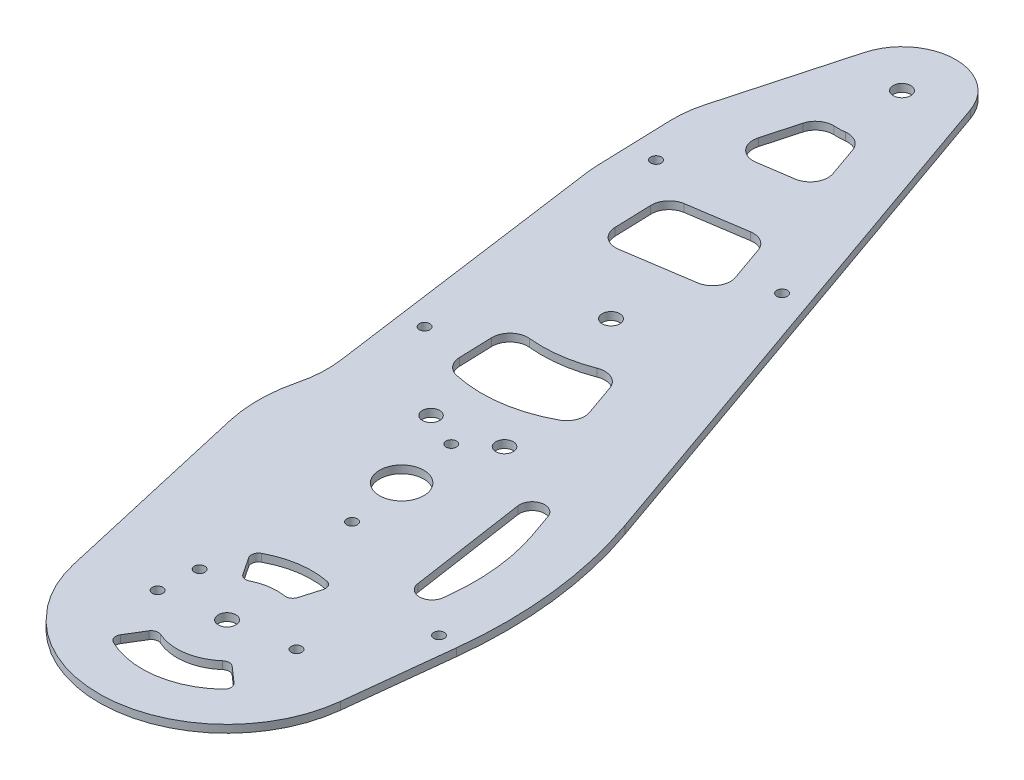
from build123d import *

# Parameters (mm, degrees)
SKETCH1_R           = 1.475
SKETCH1_R_2         = 2.455
SKETCH1_R_3         = 6.168108907
SKETCH1_R_4         = 2.425
BOSS_EXTRUDE1_DEPTH = 2.15


with BuildPart() as part:
    # Sketch1 → Boss-Extrude1 (new body)
    with BuildSketch(Plane(origin=(0, 0, 0), x_dir=(1, 0, 0), z_dir=(0, 1, 0))):
        with BuildLine():
            Line((-52.840792328, -53.480936505), (-39.943608053, -109.938847508))
            ThreePointArc((-39.943608053, -109.938847508), (-37.457286515, -117.158015126), (-33.49327647, -123.683718173))
            add(Edge.make_bspline(
                [(-33.49327647, -123.683718173), (-32.332703554, -125.083194688), (-31.130656762, -126.449768735), (-29.823601535, -127.783624049)],
                knots=[0.313138539, 0.313138539, 0.313138539, 0.313138539, 0.333887075, 0.333887075, 0.333887075, 0.333887075], degree=3))
            ThreePointArc((-29.823601535, -127.783624049), (7.100721182, -135.542158296), (30.379831892, -105.849003085))
            Line((30.379831892, -105.849003085), (33.615544776, -76.788996458))
            ThreePointArc((33.615544776, -76.788996458), (33.579883022, -49.913647939), (27.563931512, -23.720252642))
            Line((27.563931512, -23.720252642), (-24.684189405, 124.939833717))
            ThreePointArc((-24.684189405, 124.939833717), (-39.358339148, 134.957060264), (-53.29909759, 123.942036322))
            Line((-53.29909759, 123.942036322), (-62.855086574, 89.179051807))
            ThreePointArc((-62.855086574, 89.179051807), (-63.719958197, 84.755177464), (-63.912240207, 80.251657202))
            Line((-63.912240207, 80.251657202), (-63.229975042, 59.284277029))
            ThreePointArc((-63.229975042, 59.284277029), (-63.13826073, 57.721544859), (-62.965154571, 56.165724302))
            Line((-62.965154571, 56.165724302), (-52.006314121, -23.382858795))
            ThreePointArc((-52.006314121, -23.382858795), (-51.770839114, -29.123543867), (-52.634069461, -34.803838485))
            ThreePointArc((-52.634069461, -34.803838485), (-53.842880044, -44.130152103), (-52.840792328, -53.480936505))
        make_face()
        with Locations(Location((-21.173132912, -93.573319355, 0), (0, 0, 90))):
            Circle(SKETCH1_R, mode=Mode.SUBTRACT)
        with Locations(Location((-21.93278743, -104.537739321, 0), (0, 0, 90))):
            Circle(SKETCH1_R, mode=Mode.SUBTRACT)
        with Locations(Location((-5.125534576, -101.985044369, 0), (0, 0, 90))):
            Circle(SKETCH1_R_2, mode=Mode.SUBTRACT)
        with Locations(Location((11.681718278, -99.432349418, 0), (0, 0, 90))):
            Circle(SKETCH1_R, mode=Mode.SUBTRACT)
        with Locations(Location((28.194366713, -76.18652158, 0), (0, 0, 90))):
            Circle(SKETCH1_R, mode=Mode.SUBTRACT)
        with Locations(Location((-11.367714255, -60.885777039, 0), (0, 0, 90))):
            Circle(SKETCH1_R, mode=Mode.SUBTRACT)
        with Locations(Location((-13.845329944, -44.572855151, 0), (0, 0, 90))):
            Circle(SKETCH1_R_3, mode=Mode.SUBTRACT)
        with Locations(Location((-8.250860135, -21.470865896, 0), (0, 0, 90))):
            Circle(SKETCH1_R_4, mode=Mode.SUBTRACT)
        with Locations(Location((-16.322945632, -28.259933264, 0), (0, 0, 90))):
            Circle(SKETCH1_R, mode=Mode.SUBTRACT)
        with Locations(Location((-26.046774921, -24.173719374, 0), (0, 0, 90))):
            Circle(SKETCH1_R_4, mode=Mode.SUBTRACT)
        with Locations(Location((-56.366174752, 68.898827029, 0), (0, 0, 90))):
            Circle(SKETCH1_R, mode=Mode.SUBTRACT)
        with Locations(Location((-6.607589019, 54.284808215, 0), (0, 0, 90))):
            Circle(SKETCH1_R, mode=Mode.SUBTRACT)
        with Locations(Location((-24.303871319, 24.287448452, 0), (0, 0, 90))):
            Circle(SKETCH1_R_2, mode=Mode.SUBTRACT)
        with Locations(Location((-48.382600793, -3.644876674, 0), (0, 0, 90))):
            Circle(SKETCH1_R, mode=Mode.SUBTRACT)
        with Locations(Location((-38.835609181, 119.966171251, 0), (0, 0, 90))):
            Circle(SKETCH1_R_2, mode=Mode.SUBTRACT)
        with BuildLine():
            Line((-41.91710805, 82.298512317), (-32.399713849, 83.698520129))
            ThreePointArc((-32.399713849, 83.698520129), (-28.847563923, 86.060107453), (-28.410242809, 90.303174036))
            Line((-28.410242809, 90.303174036), (-31.382797644, 98.76089942))
            ThreePointArc((-31.382797644, 98.76089942), (-33.457293561, 101.347588782), (-36.693970949, 102.067598958))
            ThreePointArc((-36.693970949, 102.067598958), (-38.207418623, 101.950875498), (-39.725320718, 101.961896263))
            ThreePointArc((-39.725320718, 101.961896263), (-42.903984368, 101.018184144), (-44.793265793, 98.293278483))
            Line((-44.793265793, 98.293278483), (-47.465939738, 88.570567092))
            ThreePointArc((-47.465939738, 88.570567092), (-46.389618839, 83.932250043), (-41.91710805, 82.298512317))
        make_face(mode=Mode.SUBTRACT)
        with BuildLine():
            Line((-16.937854779, 51.629343597), (-20.390607974, 61.453363659))
            ThreePointArc((-20.390607974, 61.453363659), (-22.532582385, 64.081327612), (-25.858540532, 64.738785834))
            Line((-25.858540532, 64.738785834), (-41.906447635, 62.301420739))
            ThreePointArc((-41.906447635, 62.301420739), (-44.999859253, 60.55531199), (-46.153010078, 57.195500332))
            Line((-46.153010078, 57.195500332), (-45.817934871, 46.897965596))
            ThreePointArc((-45.817934871, 46.897965596), (-44.01778071, 43.216372089), (-40.069787164, 42.117266677))
            Line((-40.069787164, 42.117266677), (-20.904202072, 45.028146446))
            ThreePointArc((-20.904202072, 45.028146446), (-17.369143264, 47.396290594), (-16.937854779, 51.629343597))
        make_face(mode=Mode.SUBTRACT)
        with BuildLine():
            Line((-4.684973442, -1.328746966), (-7.754910594, 7.406057543))
            ThreePointArc((-7.754910594, 7.406057543), (-10.380057687, 10.289487703), (-14.277602246, 10.410785518))
            ThreePointArc((-14.277602246, 10.410785518), (-22.451748997, 8.304334218), (-30.891622317, 8.154833286))
            ThreePointArc((-30.891622317, 8.154833286), (-34.803601388, 6.83156599), (-36.385841207, 3.016971156))
            Line((-36.385841207, 3.016971156), (-36.0857593, -6.205149132))
            ThreePointArc((-36.0857593, -6.205149132), (-34.939447101, -9.23149884), (-32.179883099, -10.921951659))
            ThreePointArc((-32.179883099, -10.921951659), (-19.269492954, -11.43913062), (-7.004755403, -7.374421459))
            ThreePointArc((-7.004755403, -7.374421459), (-4.733969724, -4.777844919), (-4.684973442, -1.328746966))
        make_face(mode=Mode.SUBTRACT)
        with BuildLine():
            Line((19.844449525, -64.919654726), (19.667617674, -66.50778536))
            ThreePointArc((19.667617674, -66.50778536), (16.251850056, -69.619905943), (12.726728897, -66.632217245))
            Line((12.726728897, -66.632217245), (7.887886505, -33.893633842))
            ThreePointArc((7.887886505, -33.893633842), (10.510299936, -29.984172811), (14.652269896, -32.221363596))
            Line((14.652269896, -32.221363596), (16.818642893, -38.385282818))
            ThreePointArc((16.818642893, -38.385282818), (19.826618648, -51.481980466), (19.844449525, -64.919654726))
        make_face(mode=Mode.SUBTRACT)
        with BuildLine():
            Line((-0.653102394, -86.753585136), (0.966375004, -81.238240696))
            ThreePointArc((0.966375004, -81.238240696), (0.756700894, -79.636373516), (-0.56827267, -78.712043082))
            ThreePointArc((-0.56827267, -78.712043082), (-8.686544033, -78.538926638), (-16.387320245, -81.114648864))
            ThreePointArc((-16.387320245, -81.114648864), (-17.378099073, -82.390697064), (-17.102704245, -83.982582545))
            Line((-17.102704245, -83.982582545), (-13.91868529, -88.768369276))
            ThreePointArc((-13.91868529, -88.768369276), (-12.769636594, -89.592800652), (-11.362539974, -89.451099911))
            ThreePointArc((-11.362539974, -89.451099911), (-7.227753948, -88.143777313), (-2.891266968, -88.164478235))
            ThreePointArc((-2.891266968, -88.164478235), (-1.505550947, -87.882005033), (-0.653102394, -86.753585136))
        make_face(mode=Mode.SUBTRACT)
        with BuildLine():
            Line((6.78872402, -112.475537308), (11.102902912, -116.274167565))
            ThreePointArc((11.102902912, -116.274167565), (11.780924168, -117.740533437), (11.154170887, -119.22953378))
            ThreePointArc((11.154170887, -119.22953378), (-1.564525119, -125.4311621), (-15.551007519, -123.285531193))
            ThreePointArc((-15.551007519, -123.285531193), (-16.591599383, -122.049768162), (-16.379535287, -120.44821563))
            Line((-16.379535287, -120.44821563), (-13.387764062, -115.539953588))
            ThreePointArc((-13.387764062, -115.539953588), (-12.272305428, -114.670613587), (-10.860697091, -114.756415123))
            ThreePointArc((-10.860697091, -114.756415123), (-3.023315204, -115.826311425), (4.142973552, -112.477649245))
            ThreePointArc((4.142973552, -112.477649245), (5.465449668, -111.976593436), (6.78872402, -112.475537308))
        make_face(mode=Mode.SUBTRACT)
    extrude(amount=BOSS_EXTRUDE1_DEPTH)


solid = part.part
